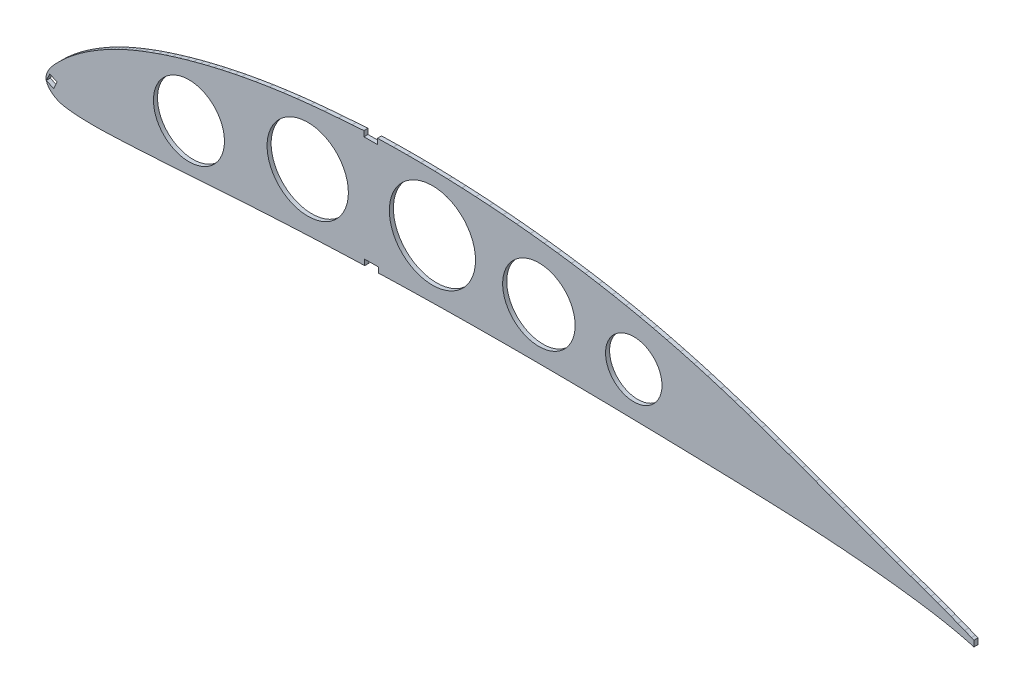
from build123d import *

# Parameters (mm, degrees)
MODEL_R         = 13.084634334
MODEL_R_2       = 10.401275396
MODEL_R_3       = 14.977427864
MODEL_R_4       = 15.880273782
MODEL_R_5       = 13.353147906
EXTRUDE_1_DEPTH = 1.5


with BuildPart() as part:
    # Model → 凸台-拉伸1 (new body)
    with BuildSketch(Plane.XY):
        Polygon((1316.872159158, -3.96823974), (1316.872159158, -1.816949822), (1315.936742864, -1.417870041), (1313.438431736, -0.398592598), (1310.930320101, 0.59902959), (1308.451757822, 1.556541485), (1305.966466344, 2.494286795), (1303.474555651, 3.415263504), (1300.978171045, 4.323395598), (1298.478458502, 5.222643728), (1295.977636645, 6.118930537), (1293.474779472, 7.01429134), (1288.476463697, 8.815748922), (1283.484620491, 10.629977794), (1278.49710455, 12.453053969), (1273.513915875, 14.284977447), (1268.530873846, 16.120898236), (1263.547905141, 17.958817681), (1258.562901119, 19.795811121), (1253.601404361, 21.618933421), (1248.635397029, 23.428211779), (1243.663513179, 25.21368958), (1238.67946355, 26.967592171), (1233.681808876, 28.677964282), (1228.665259224, 30.336994599), (1223.627449323, 31.934763167), (1218.676985403, 33.431261407), (1213.706929935, 34.857430626), (1208.717282918, 36.213270824), (1203.708970356, 37.496746683), (1198.681992249, 38.707858205), (1193.638310592, 39.845532737), (1188.575853405, 40.907844947), (1183.58212159, 41.879576678), (1178.576719524, 42.778687439), (1173.559720531, 43.607175886), (1168.532270586, 44.369002667), (1163.494406349, 45.065167111), (1158.447237134, 45.69863054), (1153.39179893, 46.270355619), (1148.361069553, 46.779132513), (1143.326178482, 47.229022395), (1138.287089056, 47.619025935), (1133.244763942, 47.948107146), (1128.199239801, 48.217265354), (1123.148407992, 48.423575899), (1118.095303161, 48.567928125), (1113.032930013, 48.650578663), (1107.972134507, 48.667126924), (1102.910991311, 48.619644886), (1097.075692717, 48.50523815), (1097.089751345, 46.486327442), (1092.092736259, 46.451530869), (1092.078809653, 48.451482381), (1087.736632533, 48.132265069), (1082.684276384, 47.743600786), (1077.575105167, 47.341641232), (1072.473104281, 46.862366826), (1067.381161723, 46.3026696), (1062.299094185, 45.657552915), (1057.229826327, 44.92490813), (1052.175210157, 44.100664612), (1047.136061695, 43.17978906), (1044.568740299, 42.672570324), (1042.007424331, 42.138113109), (1039.452187117, 41.578416068), (1036.903954659, 40.991443885), (1034.360728304, 40.377269884), (1031.824506705, 39.73582074), (1029.294253875, 39.066133788), (1026.704243615, 38.349606153), (1024.124089448, 37.60169608), (1021.553718052, 36.820404914), (1018.995018097, 36.002661347), (1016.447989583, 35.148465381), (1013.913485191, 34.253783042), (1011.393430254, 33.316542352), (1010.092128187, 32.813912338), (1008.795346157, 32.298107756), (1007.504120154, 31.77009127), (1006.219376181, 31.227827565), (1004.941150902, 30.672315968), (1003.671369647, 30.1014845), (1002.408996428, 29.514370495), (1001.093934396, 28.882157831), (999.78816907, 28.230591323), (998.491773774, 27.561669627), (997.203602532, 26.871432094), (995.924727997, 26.161840717), (994.652042199, 25.430007498), (993.386581128, 24.676895104), (992.026918346, 23.838178752), (990.680366273, 22.974965271), (989.350995542, 22.08910667), (988.044875444, 21.182381635), (986.765077285, 20.256678836), (985.518669683, 19.313740296), (984.308723944, 18.355454688), (983.58535499, 17.758573328), (982.871649359, 17.152331402), (982.164352436, 16.529843601), (981.455322952, 15.887405907), (980.742378943, 15.220095005), (980.017232495, 14.520209565), (979.276775639, 13.78486159), (978.281557642, 12.760659394), (977.31123178, 11.678505652), (976.427490278, 10.556150558), (975.693840707, 9.406274344), (975.17086598, 8.243665883), (974.921147665, 7.083040722), (975.008266657, 5.93907775), (975.34914152, 5.07198749), (975.636207643, 4.562130722), (976.131945204, 3.918523489), (976.72127069, 3.316513131), (977.382638833, 2.768898139), (978.095320381, 2.283443701), (978.839695395, 1.870876327), (979.511191617, 1.572057279), (980.19077352, 1.329979942), (980.876185817, 1.137722345), (981.566099225, 0.986327201), (982.261219778, 0.867763225), (982.960181533, 0.772073802), (983.660729202, 0.692336961), (984.914134541, 0.571303681), (986.171307759, 0.471146299), (987.431286188, 0.392900804), (988.694995834, 0.334531878), (989.959328727, 0.293151524), (991.224321531, 0.269759069), (992.490863587, 0.261319868), (993.75799223, 0.268869912), (995.023562157, 0.288485211), (996.288536034, 0.319129777), (997.552840539, 0.358804955), (998.816402347, 0.405512088), (1000.081146792, 0.457179198), (1001.345038555, 0.512880281), (1002.611002297, 0.570506696), (1003.877002701, 0.629132438), (1005.143113089, 0.690756164), (1006.408260812, 0.75341588), (1007.674481186, 0.818037589), (1008.939812217, 0.885693943), (1010.206215899, 0.95531229), (1012.741278549, 1.101470957), (1015.2746725, 1.256696896), (1017.80828642, 1.417918802), (1020.340121655, 1.585209998), (1022.873066202, 1.755462515), (1025.405084745, 1.927750349), (1027.938139278, 2.101000849), (1030.472119815, 2.272216032), (1033.005064362, 2.442468549), (1035.537898925, 2.609723083), (1038.070696825, 2.775978289), (1040.603384741, 2.939235512), (1043.136962, 3.09945809), (1045.671428601, 3.256646023), (1050.733999221, 3.561248582), (1055.797055906, 3.851823891), (1060.859562665, 4.127409284), (1065.921556162, 4.389004089), (1070.985961055, 4.634499665), (1076.051814679, 4.864932001), (1081.11904371, 5.078302443), (1086.17869086, 5.275940272), (1091.237678101, 5.455590203), (1092.375698987, 5.492634555), (1092.361326936, 7.556554934), (1097.360160683, 7.591688154), (1097.373806344, 5.632082128), (1101.354928813, 5.767884998), (1106.414118288, 5.898494546), (1111.474756494, 6.014040855), (1116.537732773, 6.111489279), (1121.594163161, 6.194167757), (1126.649970301, 6.259857664), (1131.705264178, 6.311556983), (1136.759971468, 6.347267057), (1141.814202157, 6.369985872), (1146.870917566, 6.378604113), (1151.928192363, 6.375193759), (1156.982991902, 6.358865468), (1162.035352847, 6.330618568), (1167.087273851, 6.290379735), (1172.138791578, 6.239148296), (1177.189869364, 6.175924925), (1182.242542528, 6.101635626), (1187.295811741, 6.01631706), (1192.34771501, 5.921041878), (1197.398215673, 5.814810752), (1202.446461049, 5.701657656), (1207.49541246, 5.580473276), (1212.544143901, 5.45329293), (1217.594690688, 5.321042622), (1222.646090157, 5.184758341), (1227.69734298, 5.04447675), (1232.747266519, 4.89523787), (1237.794714802, 4.733081053), (1242.841429852, 4.550937681), (1247.887265022, 4.344810444), (1252.932926346, 4.106668058), (1257.977267852, 3.832549873), (1263.027101523, 3.517202619), (1268.072250775, 3.155996274), (1273.113678274, 2.74789485), (1278.151274035, 2.289900361), (1283.183855421, 1.777052833), (1288.213384428, 1.208279612), (1293.238751741, 0.580619379), (1295.766952771, 0.23970216), (1298.292385251, -0.122127618), (1300.812903879, -0.508793943), (1303.326253367, -0.927218786), (1305.833286398, -1.381436118), (1308.330785016, -1.877331923), (1310.819601905, -2.418940171), (1313.344193548, -3.021901227), (1315.858104806, -3.670501404), align=None)
        Polygon((975.042326462, 5.93907775), (976.318336298, 8.654183438), (979.005692646, 7.391214874), (977.729682809, 4.676109186), align=None, mode=Mode.SUBTRACT)
        with Locations((1027.597597235, 19.343998537)):
            Circle(MODEL_R, mode=Mode.SUBTRACT)
        with Locations((1191.511844454, 22.015402405)):
            Circle(MODEL_R_2, mode=Mode.SUBTRACT)
        with Locations((1071.370409192, 25.768840909)):
            Circle(MODEL_R_3, mode=Mode.SUBTRACT)
        with Locations((1117.320010802, 27.618801296)):
            Circle(MODEL_R_4, mode=Mode.SUBTRACT)
        with Locations((1156.558579172, 25.138020471)):
            Circle(MODEL_R_5, mode=Mode.SUBTRACT)
    extrude(amount=EXTRUDE_1_DEPTH)


solid = part.part
